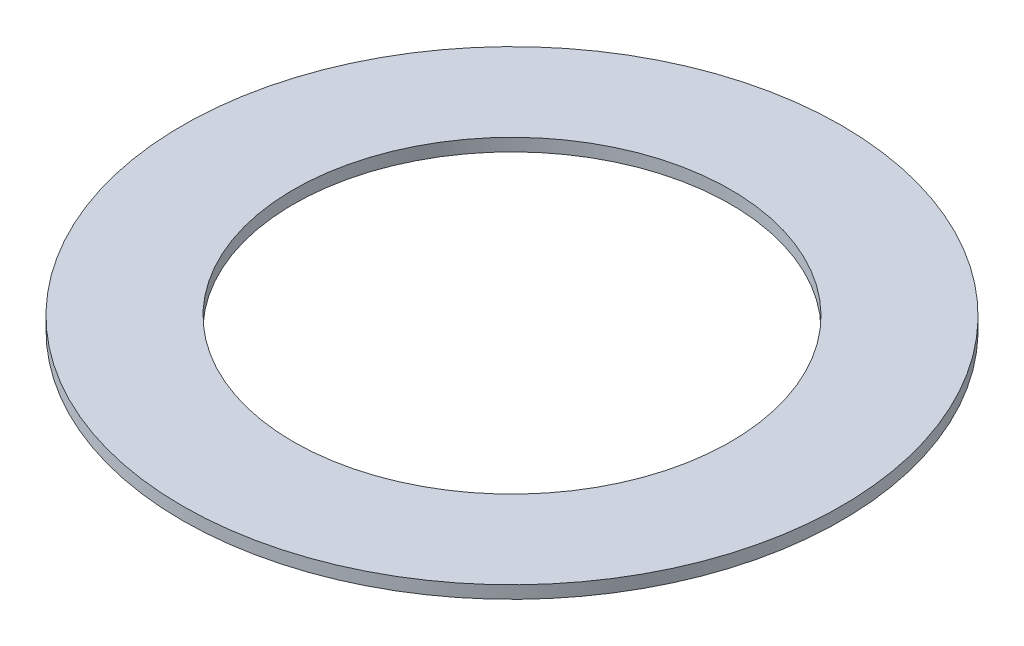
from build123d import *

# Parameters (mm, degrees)
SKETCH1_R           = 78.35
SKETCH1_R_2         = 51.95
BOSS_EXTRUDE1_DEPTH = 3


with BuildPart() as part:
    # Sketch1 → Boss-Extrude1 (new body)
    with BuildSketch(Plane(origin=(0, 0, 0), x_dir=(1, 0, 0), z_dir=(0, 1, 0))):
        with Locations(Location((0, 0, 0), (0, 0, 270))):
            Circle(SKETCH1_R)
        with Locations(Location((0, 0, 0), (0, 0, 270))):
            Circle(SKETCH1_R_2, mode=Mode.SUBTRACT)
    extrude(amount=BOSS_EXTRUDE1_DEPTH)


solid = part.part
